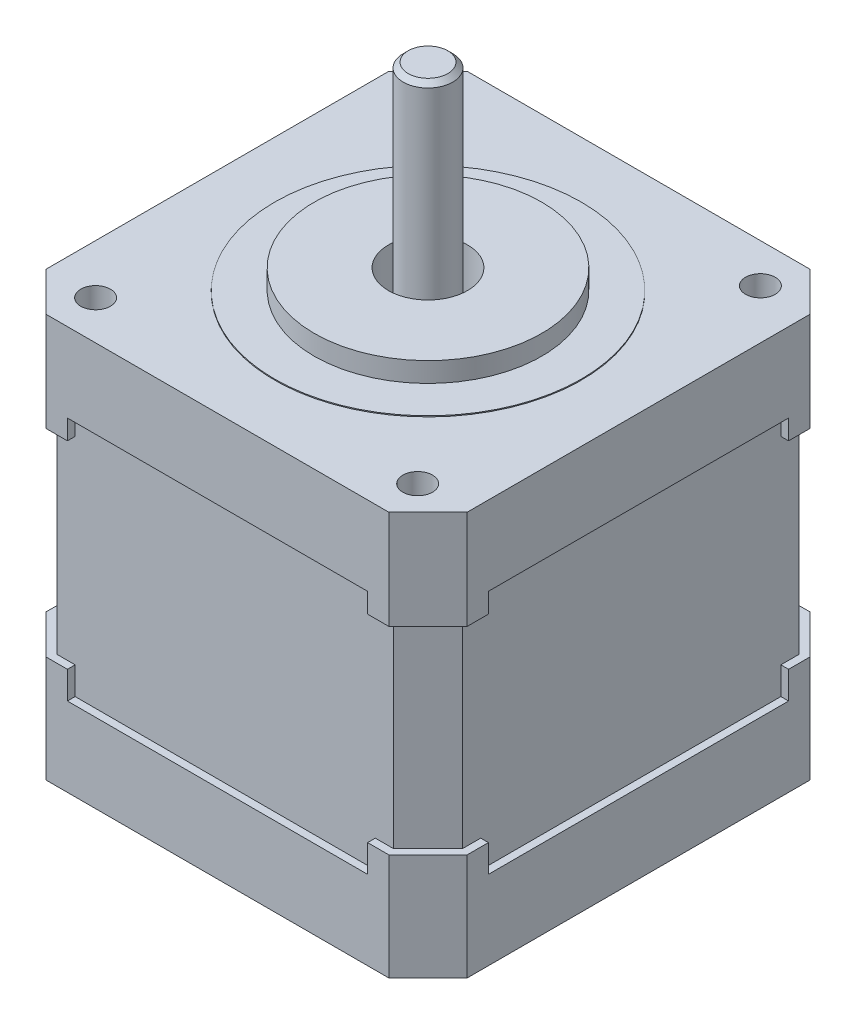
from build123d import *

# Parameters (mm, degrees)
SALIENTE_EXTRUIR2_DEPTH = 10
VACIADO6_T              = 0.78
CROQUIS2_W              = 30.346173158
CROQUIS2_H              = 2.78
CORTAR_EXTRUIR1_DEPTH   = 49.622957541
CROQUIS3_W              = 30.346173158
CROQUIS3_H              = 2.78
CORTAR_EXTRUIR2_DEPTH   = 49.622957541
SALIENTE_EXTRUIR3_DEPTH = 40
SALIENTE_EXTRUIR4_DEPTH = 10
CROQUIS6_W              = 30.346173158
CROQUIS6_H              = 2
CORTAR_EXTRUIR3_DEPTH   = 0.78
CROQUIS7_W              = 30.346173158
CROQUIS7_H              = 2
CORTAR_EXTRUIR4_DEPTH   = 0.78
CROQUIS8_W              = 30.346173158
CROQUIS8_H              = 2
CORTAR_EXTRUIR5_DEPTH   = 0.78
CROQUIS9_W              = 30.346173158
CROQUIS9_H              = 2
CORTAR_EXTRUIR6_DEPTH   = 0.78
CROQUIS10_R             = 1.5
CORTAR_EXTRUIR7_DEPTH   = 4
CROQUIS11_R             = 15.5
SALIENTE_EXTRUIR5_DEPTH = 0.1
CROQUIS12_R             = 11.5
SALIENTE_EXTRUIR6_DEPTH = 2
CROQUIS13_R             = 4
CORTAR_EXTRUIR8_DEPTH   = 5
CROQUIS14_R             = 2.5
SALIENTE_EXTRUIR7_DEPTH = 23
CHAFL_N1_SIZE           = 0.5


with BuildPart() as part:
    # Croquis1 → Saliente-Extruir2 (new body)
    with BuildSketch(Plane(origin=(0, 0, 0), x_dir=(1, 0, 0), z_dir=(0, 1, 0))):
        Polygon((20.5, 17), (17, 20.5), (-17, 20.5), (-20.5, 17), (-20.5, -17), (-17, -20.5), (17, -20.5), (20.5, -17), align=None)
    extrude(amount=SALIENTE_EXTRUIR2_DEPTH)

    # Vaciado6
    vaciado6_openings = [part.faces().sort_by_distance(p)[0] for p in [
        (0, 10, 0),
    ]]
    offset(amount=VACIADO6_T, openings=vaciado6_openings, kind=Kind.INTERSECTION)

    # Croquis2 → Cortar-Extruir1 (cut, through all)
    with BuildSketch(Plane(origin=(21.28, 0, 0), x_dir=(0, 0, -1), z_dir=(1, 0, 0))):
        with Locations((0, 8.61)):
            Rectangle(CROQUIS2_W, CROQUIS2_H)
    extrude(amount=-CORTAR_EXTRUIR1_DEPTH, mode=Mode.SUBTRACT)

    # Croquis3 → Cortar-Extruir2 (cut, through all)
    with BuildSketch(Plane.XY.offset(21.28)):
        with Locations((0, 8.61)):
            Rectangle(CROQUIS3_W, CROQUIS3_H)
    extrude(amount=-CORTAR_EXTRUIR2_DEPTH, mode=Mode.SUBTRACT)

    # Croquis4 → Saliente-Extruir3 (add)
    with BuildSketch(Plane(origin=(0, 0, 0), x_dir=(1, 0, 0), z_dir=(0, 1, 0))):
        Polygon((-17, 20.5), (17, 20.5), (20.5, 17), (20.5, -17), (17, -20.5), (-17, -20.5), (-20.5, -17), (-20.5, 17), align=None)
    extrude(amount=SALIENTE_EXTRUIR3_DEPTH)

    # Croquis5 → Saliente-Extruir4 (add)
    with BuildSketch(Plane(origin=(0, 40, 0), x_dir=(1, 0, 0), z_dir=(0, 1, 0))):
        Polygon((-21.28, 17.323086579), (-17.323086579, 21.28), (17.323086579, 21.28), (21.28, 17.323086579), (21.28, -17.323086579), (17.323086579, -21.28), (-17.323086579, -21.28), (-21.28, -17.323086579), align=None)
    extrude(amount=-SALIENTE_EXTRUIR4_DEPTH)

    # Croquis6 → Cortar-Extruir3 (cut)
    with BuildSketch(Plane.XY.offset(21.28)):
        with Locations((0, 31)):
            Rectangle(CROQUIS6_W, CROQUIS6_H)
    extrude(amount=-CORTAR_EXTRUIR3_DEPTH, mode=Mode.SUBTRACT)

    # Croquis7 → Cortar-Extruir4 (cut)
    with BuildSketch(Plane(origin=(0, 0, -21.28), x_dir=(-1, 0, 0), z_dir=(0, 0, -1))):
        with Locations((0, 31)):
            Rectangle(CROQUIS7_W, CROQUIS7_H)
    extrude(amount=-CORTAR_EXTRUIR4_DEPTH, mode=Mode.SUBTRACT)

    # Croquis8 → Cortar-Extruir5 (cut)
    with BuildSketch(Plane.ZY.offset(21.28)):
        with Locations((0, 31)):
            Rectangle(CROQUIS8_W, CROQUIS8_H)
    extrude(amount=-CORTAR_EXTRUIR5_DEPTH, mode=Mode.SUBTRACT)

    # Croquis9 → Cortar-Extruir6 (cut)
    with BuildSketch(Plane(origin=(21.28, 0, 0), x_dir=(0, 0, -1), z_dir=(1, 0, 0))):
        with Locations((0, 31)):
            Rectangle(CROQUIS9_W, CROQUIS9_H)
    extrude(amount=-CORTAR_EXTRUIR6_DEPTH, mode=Mode.SUBTRACT)

    # Croquis10 → Cortar-Extruir7 (cut)
    with BuildSketch(Plane(origin=(0, 40, 0), x_dir=(1, 0, 0), z_dir=(0, 1, 0))):
        with Locations(Location((-16.28, 17.323086579, 0), (0, 0, 270))):
            Circle(CROQUIS10_R)
        with Locations(Location((16.28, 17.323086579, 0), (0, 0, 270))):
            Circle(CROQUIS10_R)
        with Locations(Location((16.28, -17.323086579, 0), (0, 0, 270))):
            Circle(CROQUIS10_R)
        with Locations(Location((-16.28, -17.323086579, 0), (0, 0, 270))):
            Circle(CROQUIS10_R)
    extrude(amount=-CORTAR_EXTRUIR7_DEPTH, mode=Mode.SUBTRACT)

    # Croquis11 → Saliente-Extruir5 (add)
    with BuildSketch(Plane(origin=(0, 40, 0), x_dir=(1, 0, 0), z_dir=(0, 1, 0))):
        with Locations(Location((0, 0, 0), (0, 0, 90))):
            Circle(CROQUIS11_R)
    extrude(amount=SALIENTE_EXTRUIR5_DEPTH)

    # Croquis12 → Saliente-Extruir6 (add)
    with BuildSketch(Plane(origin=(0, 40.1, 0), x_dir=(1, 0, 0), z_dir=(0, 1, 0))):
        with Locations(Location((0, 0, 0), (0, 0, 270))):
            Circle(CROQUIS12_R)
    extrude(amount=SALIENTE_EXTRUIR6_DEPTH)

    # Croquis13 → Cortar-Extruir8 (cut)
    with BuildSketch(Plane(origin=(0, 42.1, 0), x_dir=(1, 0, 0), z_dir=(0, 1, 0))):
        with Locations(Location((0, 0, 0), (0, 0, 270))):
            Circle(CROQUIS13_R)
    extrude(amount=-CORTAR_EXTRUIR8_DEPTH, mode=Mode.SUBTRACT)

    # Croquis14 → Saliente-Extruir7 (add)
    with BuildSketch(Plane(origin=(0, 37.1, 0), x_dir=(1, 0, 0), z_dir=(0, 1, 0))):
        with Locations(Location((0, 0, 0), (0, 0, 270))):
            Circle(CROQUIS14_R)
    extrude(amount=SALIENTE_EXTRUIR7_DEPTH)

    # Chaflán1
    chafl_n1_edges = [part.edges().sort_by_distance(p)[0] for p in [
        (0, 60.1, -2.5),
    ]]
    chamfer(chafl_n1_edges, length=CHAFL_N1_SIZE)


solid = part.part
